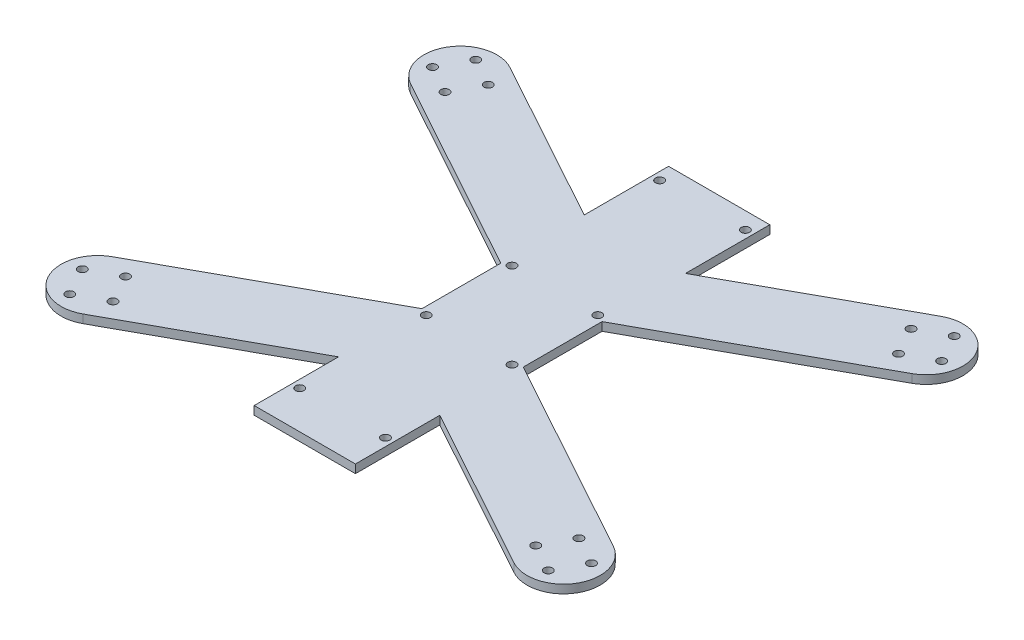
from build123d import *

# Parameters (mm, degrees)
SKETCH1_R               = 1.5
BOSS_EXTRUDE1_DEPTH     = 3
SKETCH2_R               = 1.5
CUT_EXTRUDE1_DEPTH      = 124.30125084
MIRROR2_COPY_1_SKETCH_R = 1.5
MIRROR2_COPY_1_DEPTH    = 124.30125084


with BuildPart() as part:
    # Sketch1 → Boss-Extrude1 (new body)
    with BuildSketch(Plane(origin=(0, 0, 0), x_dir=(1, 0, 0), z_dir=(0, 1, 0))):
        with BuildLine():
            Line((-89.116425142, 53.107925476), (-18, 14.012636522))
            Line((-18, 14.012636522), (-18, -14.012636522))
            Line((-18, -14.012636522), (-89.116425142, -53.107925476))
            ThreePointArc((-89.116425142, -53.107925476), (-94.245861402, -70.762638264), (-76.591148614, -75.892074524))
            Line((-76.591148614, -75.892074524), (-18, -43.682386248))
            Line((-18, -43.682386248), (-18, -73.682386248))
            Line((-18, -73.682386248), (18, -73.682386248))
            Line((18, -73.682386248), (18, -43.682386248))
            Line((18, -43.682386248), (76.591148614, -75.892074524))
            ThreePointArc((76.591148614, -75.892074524), (94.245861402, -70.762638264), (89.116425142, -53.107925476))
            Line((89.116425142, -53.107925476), (18, -14.012636522))
            Line((18, -14.012636522), (18, 14.012636522))
            Line((18, 14.012636522), (89.116425142, 53.107925476))
            ThreePointArc((89.116425142, 53.107925476), (94.245861402, 70.762638264), (76.591148614, 75.892074524))
            Line((76.591148614, 75.892074524), (18, 43.682386248))
            Line((18, 43.682386248), (18, 73.682386248))
            Line((18, 73.682386248), (-18, 73.682386248))
            Line((-18, 73.682386248), (-18, 43.682386248))
            Line((-18, 43.682386248), (-76.591148614, 75.892074524))
            ThreePointArc((-76.591148614, 75.892074524), (-94.245861402, 70.762638264), (-89.116425142, 53.107925476))
        make_face()
        with Locations(Location((-15.25, 15.25, 0), (0, 0, 270))):
            Circle(SKETCH1_R, mode=Mode.SUBTRACT)
        with Locations(Location((-15.25, 67.75, 0), (0, 0, 270))):
            Circle(SKETCH1_R, mode=Mode.SUBTRACT)
        with Locations(Location((-15.25, -60.25, 0), (0, 0, 270))):
            Circle(SKETCH1_R, mode=Mode.SUBTRACT)
        with Locations(Location((15.25, 67.75, 0), (0, 0, 270))):
            Circle(SKETCH1_R, mode=Mode.SUBTRACT)
        with Locations(Location((15.25, 15.25, 0), (0, 0, 270))):
            Circle(SKETCH1_R, mode=Mode.SUBTRACT)
        with Locations(Location((15.25, -15.25, 0), (0, 0, 270))):
            Circle(SKETCH1_R, mode=Mode.SUBTRACT)
        with Locations(Location((-15.25, -15.25, 0), (0, 0, 270))):
            Circle(SKETCH1_R, mode=Mode.SUBTRACT)
        with Locations(Location((15.25, -60.25, 0), (0, 0, 270))):
            Circle(SKETCH1_R, mode=Mode.SUBTRACT)
    extrude(amount=BOSS_EXTRUDE1_DEPTH)

    # Sketch2 → Cut-Extrude1 (cut, through all)
    with BuildSketch(Plane(origin=(0, 3, 0), x_dir=(1, 0, 0), z_dir=(0, 1, 0))):
        with Locations(Location((-85.085823286, 72.182318236, 0), (0, 0, 270))):
            Circle(SKETCH2_R)
        with Locations(Location((-75.171468642, 66.732036408, 0), (0, 0, 270))):
            Circle(SKETCH2_R)
        with Locations(Location((-80.62175047, 56.817681764, 0), (0, 0, 90))):
            Circle(SKETCH2_R)
        with Locations(Location((-90.536105113, 62.267963592, 0), (0, 0, 90))):
            Circle(SKETCH2_R)
    cut_extrude1 = extrude(amount=-CUT_EXTRUDE1_DEPTH, mode=Mode.SUBTRACT)

    # Mirror1: Cut-Extrude1 across plane
    add(cut_extrude1.mirror(Plane.XY), mode=Mode.SUBTRACT)

    # Mirror2: Cut-Extrude1 across plane
    add(cut_extrude1.mirror(Plane(origin=(0, 0, 0), x_dir=(0, 0, 1), z_dir=(1, 0, 0))), mode=Mode.SUBTRACT)

    # Mirror2 copy 1 sketch → Mirror2 copy 1 (cut, through all)
    with BuildSketch(Plane(origin=(0, 3, 0), x_dir=(-1, 0, 0), z_dir=(0, 1, 0))):
        with Locations(Location((-85.085823286, 72.182318236, 0), (0, 0, 270))):
            Circle(MIRROR2_COPY_1_SKETCH_R)
        with Locations(Location((-75.171468642, 66.732036408, 0), (0, 0, 270))):
            Circle(MIRROR2_COPY_1_SKETCH_R)
        with Locations(Location((-80.62175047, 56.817681764, 0), (0, 0, 90))):
            Circle(MIRROR2_COPY_1_SKETCH_R)
        with Locations(Location((-90.536105113, 62.267963592, 0), (0, 0, 90))):
            Circle(MIRROR2_COPY_1_SKETCH_R)
    extrude(amount=-MIRROR2_COPY_1_DEPTH, mode=Mode.SUBTRACT)


solid = part.part
